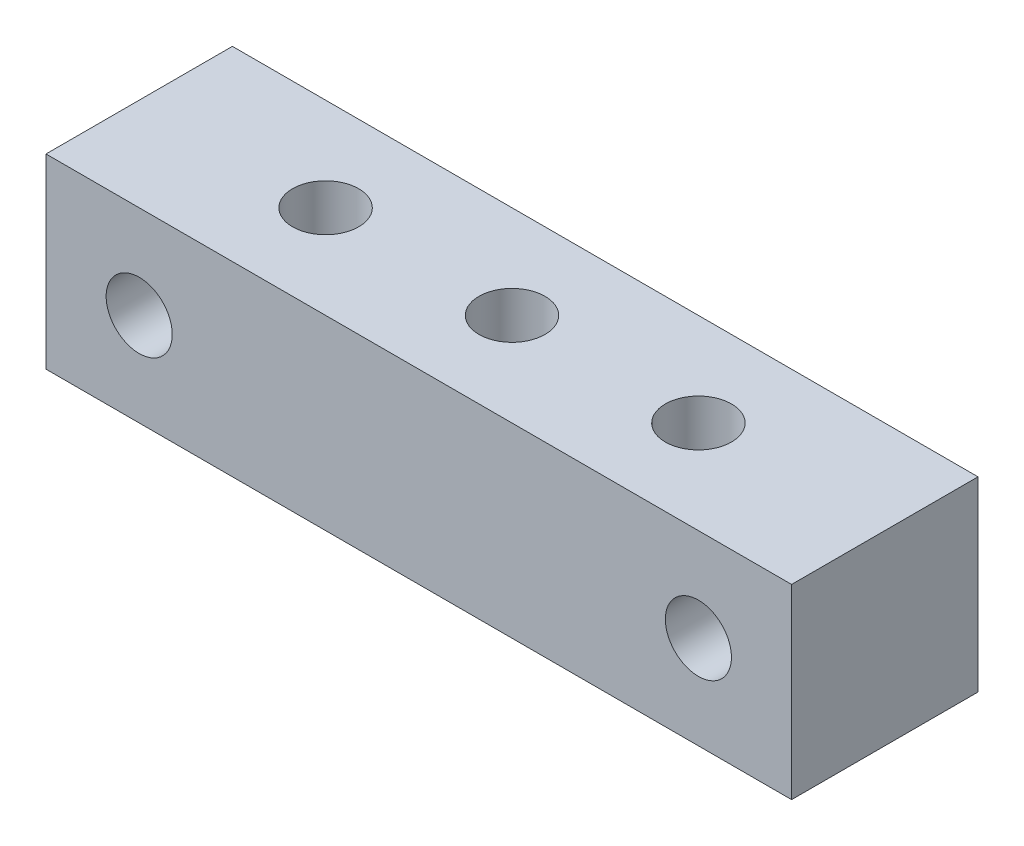
from build123d import *

# Parameters (mm, degrees)
SKETCH1_W               = 76.2
SKETCH1_H               = 19.05
BOSS_EXTRUDE1_DEPTH     = 19.05
F_1_4_CLEARANCE_HOLE1_D = 6.7564
F_1_4_CLEARANCE_HOLE2_D = 6.7564


with BuildPart() as part:
    # Sketch1 → Boss-Extrude1 (new body)
    with BuildSketch(Plane.XY):
        Rectangle(SKETCH1_W, SKETCH1_H)
    extrude(amount=BOSS_EXTRUDE1_DEPTH)

    # 1/4 Clearance Hole1 (through all)
    with Locations(Plane.XY.offset(19.05)):
        with Locations((-28.575, 0), (28.575, 0)):
            Hole(F_1_4_CLEARANCE_HOLE1_D / 2)

    # 1/4 Clearance Hole2 (through all)
    with Locations(Plane(origin=(0, 9.525, 0), x_dir=(1, 0, 0), z_dir=(0, 1, 0))):
        with Locations((0, -9.525), (-19.05, -9.525), (19.05, -9.525)):
            Hole(F_1_4_CLEARANCE_HOLE2_D / 2)


solid = part.part
